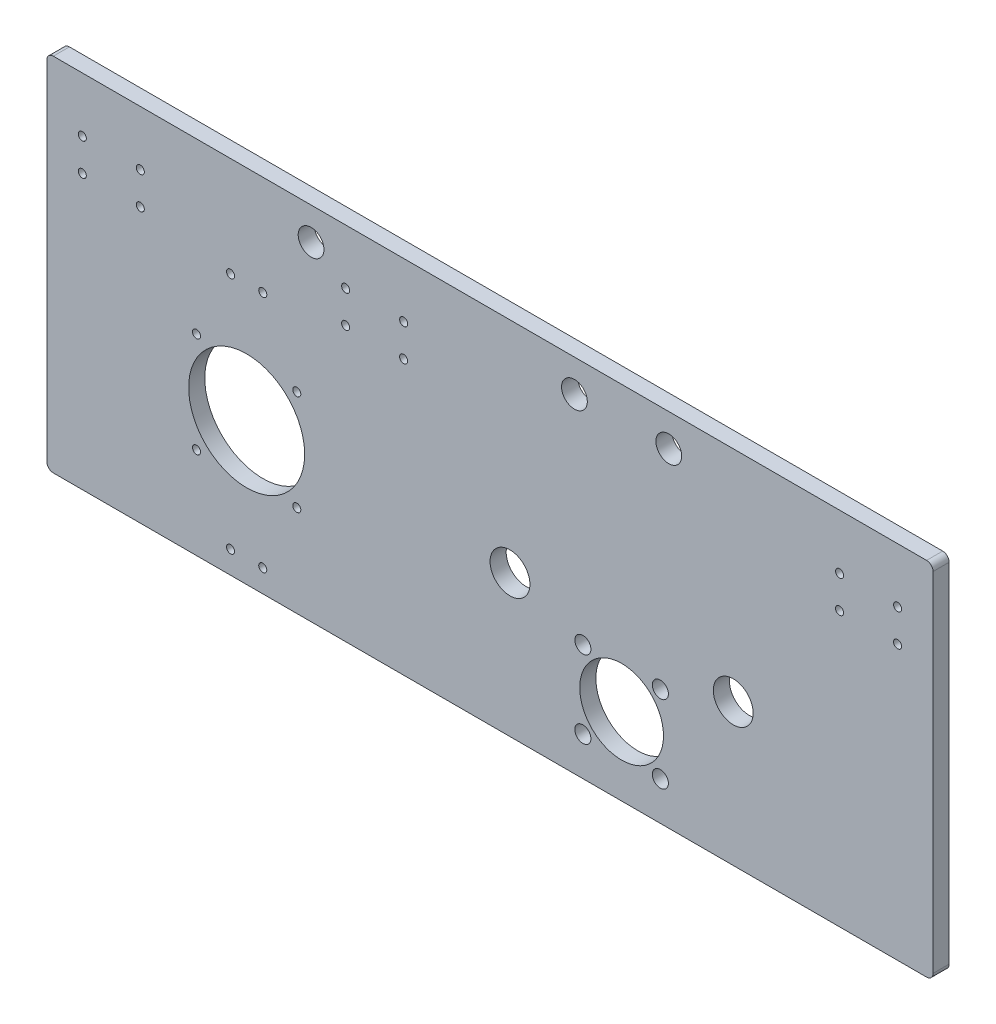
from build123d import *

# Parameters (mm, degrees)
SKETCH_1_W               = 275
SKETCH_1_H               = 112
SKETCH_1_R               = 13
SKETCH_1_R_2             = 2.5
SKETCH_1_R_3             = 6.183267946
SKETCH_1_R_4             = 18
SKETCH_1_R_5             = 4
EXTRUDE_1_DEPTH          = 5
HOLE_WIZARD_M32_D        = 2.5
HOLE_WIZARD_M31_D        = 2.5
FILLET_1_R               = 2
HOLE_WIZARD_M35_D        = 2.5
PATTERN_CIRCULAR_1_COUNT = 4


with BuildPart() as part:
    # Эскиз1 → Бобышка-Вытянуть1 (new body)
    with BuildSketch(Plane.XY):
        with Locations((-40.858983849, 32)):
            Rectangle(SKETCH_1_W, SKETCH_1_H)
        Circle(SKETCH_1_R, mode=Mode.SUBTRACT)
        with Locations((-12.02081528, 12.02081528)):
            Circle(SKETCH_1_R_2, mode=Mode.SUBTRACT)
        with Locations((12.02081528, 12.02081528)):
            Circle(SKETCH_1_R_2, mode=Mode.SUBTRACT)
        with Locations((12.02081528, -12.02081528)):
            Circle(SKETCH_1_R_2, mode=Mode.SUBTRACT)
        with Locations((-12.02081528, -12.02081528)):
            Circle(SKETCH_1_R_2, mode=Mode.SUBTRACT)
        with Locations((-34.641016151, 20)):
            Circle(SKETCH_1_R_3, mode=Mode.SUBTRACT)
        with Locations((34.641016151, 20)):
            Circle(SKETCH_1_R_3, mode=Mode.SUBTRACT)
        with Locations((-116.358983849, 20)):
            Circle(SKETCH_1_R_4, mode=Mode.SUBTRACT)
        with Locations((-14.641016151, 78)):
            Circle(SKETCH_1_R_5, mode=Mode.SUBTRACT)
        with Locations((14.641016151, 78)):
            Circle(SKETCH_1_R_5, mode=Mode.SUBTRACT)
        with Locations((-96.358983849, 78)):
            Circle(SKETCH_1_R_5, mode=Mode.SUBTRACT)
    extrude(amount=EXTRUDE_1_DEPTH)

    # Отверстие обработанное метчиком M32 (through all)
    with Locations(Plane(origin=(0, 0, 0), x_dir=(-1, 0, 0), z_dir=(0, 0, -1))):
        with Locations((111.358983849, 57), (121.358983849, 57), (111.358983849, -17), (121.358983849, -17)):
            Hole(HOLE_WIZARD_M32_D / 2)

    # Отверстие обработанное метчиком M31 (through all)
    with Locations(Plane(origin=(-167.358983849, 71, 6), x_dir=(1, 0, 0), z_dir=(0, 0, 1))):
        with Locations((0, 0), (0, -10), (18, -10), (18, 0), (81.717967698, 0), (81.717967698, -10), (99.717967698, -10), (99.717967698, 0), (235, 0), (235, -10), (253, 0), (253, -10)):
            Hole(HOLE_WIZARD_M31_D / 2)

    # Скругление1
    fillet_1_edges = [part.edges().sort_by_distance(p)[0] for p in [
        (-178.358983849, 88, 2.5),
        (96.641016151, 88, 2.5),
        (96.641016151, -24, 2.5),
        (-178.358983849, -24, 2.5),
    ]]
    fillet(fillet_1_edges, radius=FILLET_1_R)

    # Отверстие обработанное метчиком M35 (through all)
    with Locations(Plane.XY.offset(5)):
        with Locations((-100.802634663, 35.556349186)):
            hole_wizard_m35 = Hole(HOLE_WIZARD_M35_D / 2)

    # Круговой массив1: Отверстие обработанное метчиком M35 ×4 about axis
    pattern_circular_1_axis = Axis((-116.358983849, 20, 0), (0, 0, 1))
    for i in range(1, PATTERN_CIRCULAR_1_COUNT):
        add(hole_wizard_m35.rotate(pattern_circular_1_axis, i * 360 / PATTERN_CIRCULAR_1_COUNT), mode=Mode.SUBTRACT)


solid = part.part
